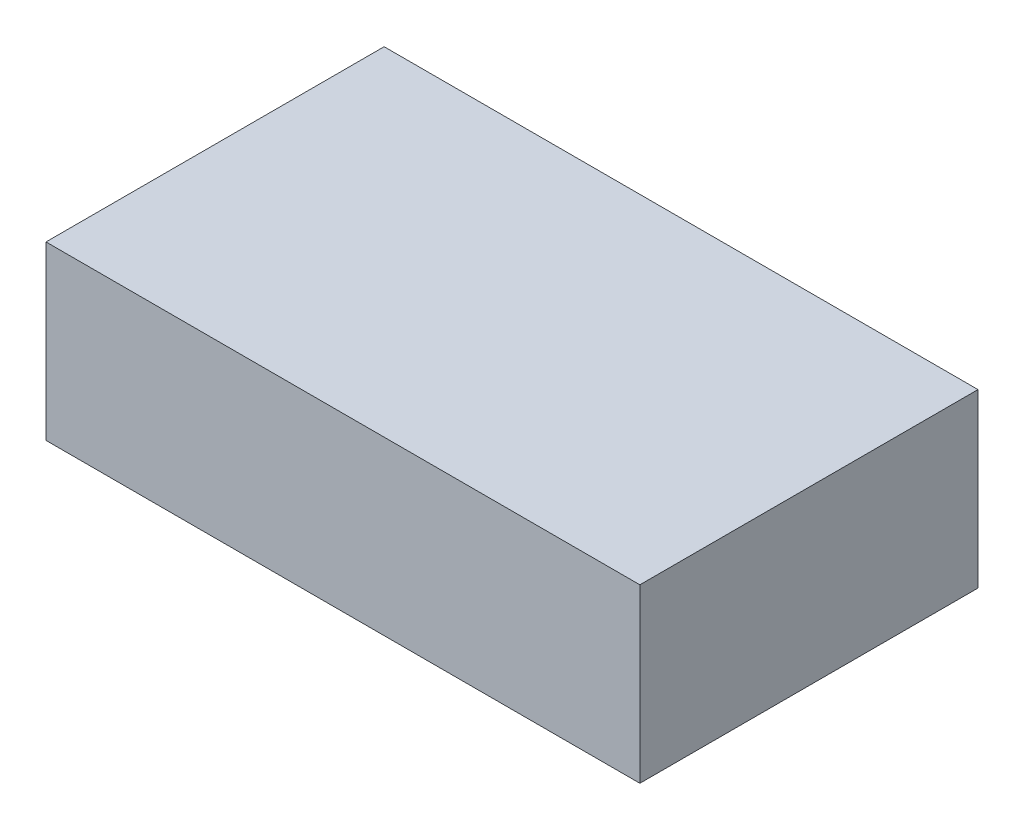
from build123d import *

# Parameters (mm, degrees)
SKETCH1_W                      = 104.5
SKETCH1_H                      = 59.5
BOSS_EXTRUDE1_DEPTH            = 30.25
SKETCH2_R                      = 2
BOSS_EXTRUDE2_DEPTH            = 10
M4_CLEARANCE_HOLE1_D           = 4.5
M4_CLEARANCE_HOLE1_DEPTH       = 10
M4_CLEARANCE_HOLE1_CSINK_D     = 4.55
M4_CLEARANCE_HOLE1_CSINK_ANGLE = 90
M4_CLEARANCE_HOLE1_TIP         = 1.351936393


with BuildPart() as part:
    # Sketch1 → Boss-Extrude1 (new body)
    with BuildSketch(Plane(origin=(0, 0, 0), x_dir=(1, 0, 0), z_dir=(0, 1, 0))):
        Rectangle(SKETCH1_W, SKETCH1_H)
    extrude(amount=BOSS_EXTRUDE1_DEPTH)

    # Sketch2 → Boss-Extrude2 (add)
    with BuildSketch(Plane.ZY.offset(52.25)):
        with Locations(Location((0, 11.6, 0), (0, 0, 180))):
            Circle(SKETCH2_R)
    extrude(amount=BOSS_EXTRUDE2_DEPTH)

    # M4 Clearance Hole1
    with Locations(Plane(origin=(0, 0, 0), x_dir=(-1, 0, 0), z_dir=(0, -1, 0))):
        with Locations((36.5, 20.5), (-36.5, 20.5), (-36.5, -20.5), (36.5, -20.5)):
            CounterSinkHole(M4_CLEARANCE_HOLE1_D / 2, M4_CLEARANCE_HOLE1_CSINK_D / 2, depth=M4_CLEARANCE_HOLE1_DEPTH, counter_sink_angle=M4_CLEARANCE_HOLE1_CSINK_ANGLE)
            with Locations((0, 0, -(M4_CLEARANCE_HOLE1_DEPTH + M4_CLEARANCE_HOLE1_TIP / 2))):  # 118° drill point
                Cone(0, M4_CLEARANCE_HOLE1_D / 2, M4_CLEARANCE_HOLE1_TIP, mode=Mode.SUBTRACT)


solid = part.part
